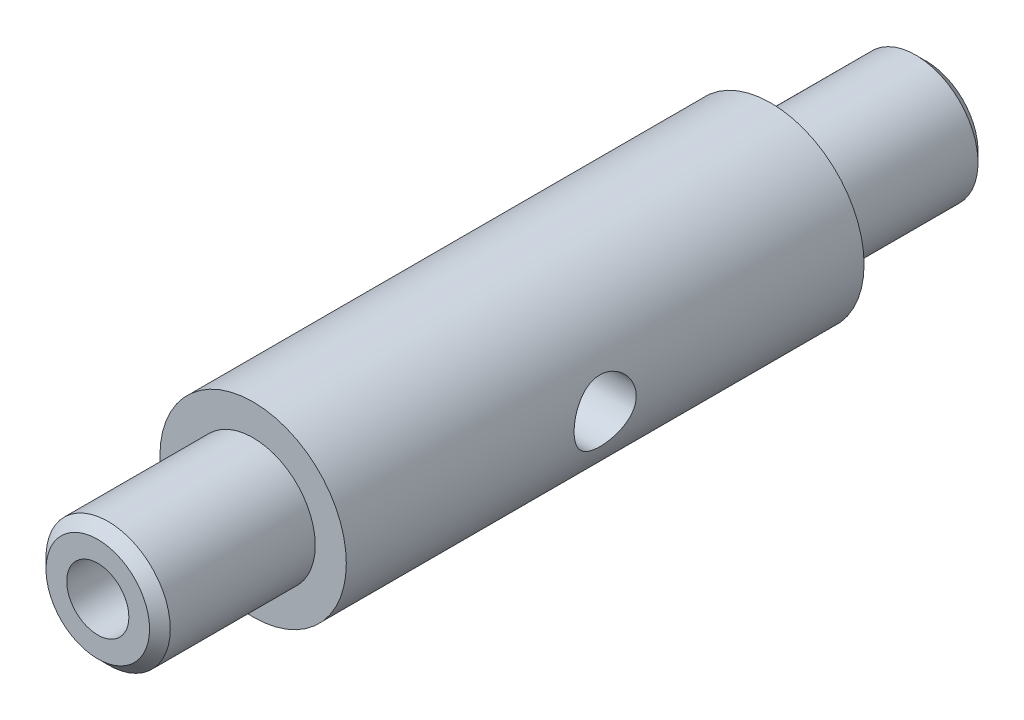
from build123d import *

# Parameters (mm, degrees)
SKETCH2_R           = 9
BOSS_EXTRUDE1_DEPTH = 25
SKETCH3_R           = 6
BOSS_EXTRUDE2_DEPTH = 15
BOSS_EXTRUDE4_START = 15
SKETCH4_R           = 6
BOSS_EXTRUDE4_DEPTH = 15
SKETCH5_R           = 3
CUT_EXTRUDE1_DEPTH  = 10
SKETCH6_R           = 3
CUT_EXTRUDE2_DEPTH  = 45
CHAMFER1_SIZE       = 1
CHAMFER2_SIZE       = 1


with BuildPart() as part:
    # Sketch2 → Boss-Extrude1 (new, symmetric)
    with BuildSketch(Plane.XY):
        Circle(SKETCH2_R)
    extrude(amount=BOSS_EXTRUDE1_DEPTH, both=True)

    # Sketch3 → Boss-Extrude2 (add)
    with BuildSketch(Plane.XY.offset(25)):
        Circle(SKETCH3_R)
    extrude(amount=BOSS_EXTRUDE2_DEPTH)

    # Sketch4 → Boss-Extrude4 (add)
    with BuildSketch(Plane(origin=(0, 0, -25), x_dir=(-1, 0, 0), z_dir=(0, 0, -1)).offset(BOSS_EXTRUDE4_START)):
        with Locations(Location((0, 0, 0), (0, 0, 180))):
            Circle(SKETCH4_R)
    extrude(amount=-BOSS_EXTRUDE4_DEPTH)

    # Sketch5 → Cut-Extrude1 (cut, symmetric)
    with BuildSketch(Plane(origin=(0, 0, 0), x_dir=(0, 0, -1), z_dir=(1, 0, 0))):
        with Locations(Location((0, 0, 0), (0, 0, 180))):
            Circle(SKETCH5_R)
    extrude(amount=CUT_EXTRUDE1_DEPTH, both=True, mode=Mode.SUBTRACT)

    # Sketch6 → Cut-Extrude2 (cut)
    with BuildSketch(Plane.XY.offset(40)):
        Circle(SKETCH6_R)
    extrude(amount=-CUT_EXTRUDE2_DEPTH, mode=Mode.SUBTRACT)

    # Sketch7 → Cut-Revolve1 (revolve, cut)
    with BuildSketch(Plane(origin=(0, 0, 0), x_dir=(1, 0, 0), z_dir=(0, 1, 0))):
        Polygon((-3, 5), (0, 8), (0, 5), align=None)
    revolve(axis=Axis((0, 0, -10.064608653), (0, 0, 1)), mode=Mode.SUBTRACT)

    # Chamfer1
    chamfer1_edges = [part.edges().sort_by_distance(p)[0] for p in [
        (-6, 0, 40),
    ]]
    chamfer(chamfer1_edges, length=CHAMFER1_SIZE)

    # Chamfer2
    chamfer2_edges = [part.edges().sort_by_distance(p)[0] for p in [
        (-6, 0, -40),
    ]]
    chamfer(chamfer2_edges, length=CHAMFER2_SIZE)


solid = part.part
